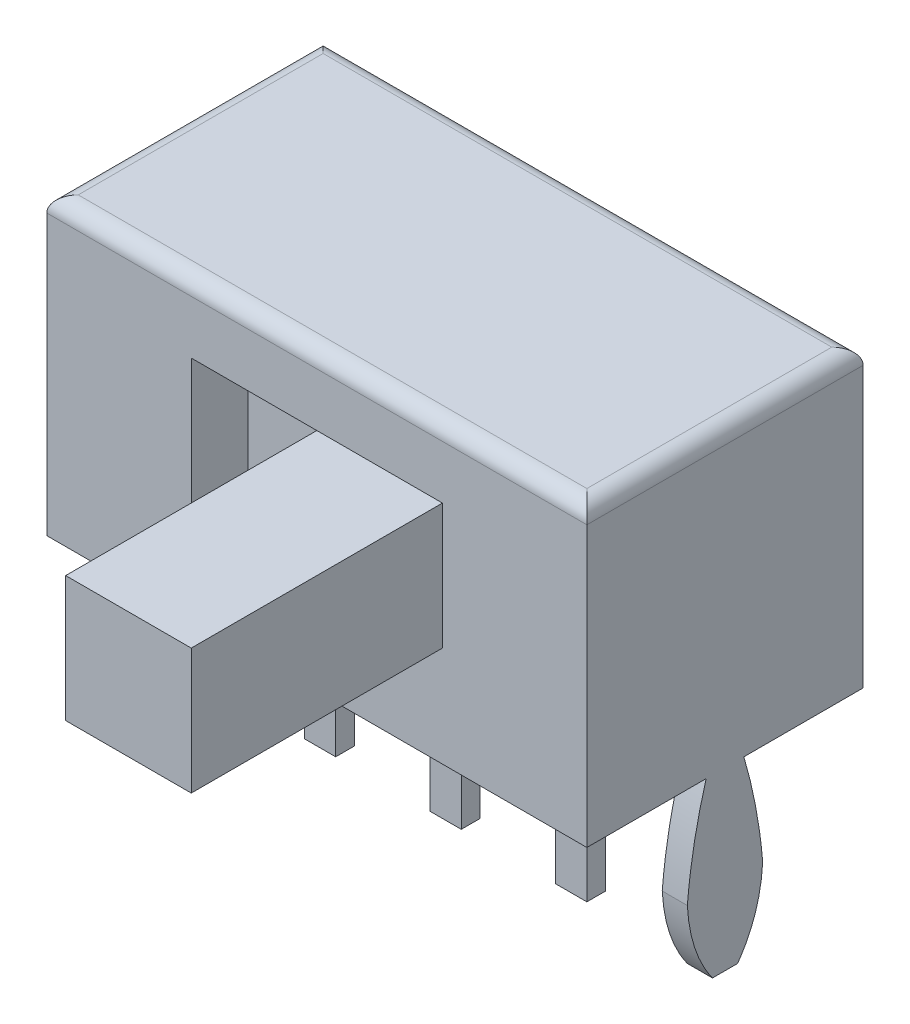
from build123d import *

# Parameters (mm, degrees)
SKETCH1_W           = 8.6
SKETCH1_H           = 4.4
BOSS_EXTRUDE1_DEPTH = 4.7
SKETCH4_W           = 4
SKETCH4_H           = 2
CUT_EXTRUDE1_DEPTH  = 0.9
SKETCH5_W           = 2
SKETCH5_H           = 2
BOSS_EXTRUDE3_DEPTH = 4.9
SKETCH7_W           = 0.4
SKETCH7_H           = 1.2
BOSS_EXTRUDE4_DEPTH = 2.8
CUT_EXTRUDE3_DEPTH  = 8.6
SKETCH9_W           = 0.5
SKETCH9_H           = 0.3
BOSS_EXTRUDE5_DEPTH = 2.8
FILLET1_R           = 0.25


with BuildPart() as part:
    # Sketch1 → Boss-Extrude1 (new body)
    with BuildSketch(Plane(origin=(0, 0, 0), x_dir=(1, 0, 0), z_dir=(0, 1, 0))):
        with Locations((4.3, -2.2)):
            Rectangle(SKETCH1_W, SKETCH1_H)
    extrude(amount=-BOSS_EXTRUDE1_DEPTH)

    # Sketch4 → Cut-Extrude1 (cut)
    with BuildSketch(Plane.XY.offset(4.4)):
        with Locations((4.3, -2.1)):
            Rectangle(SKETCH4_W, SKETCH4_H)
    extrude(amount=-CUT_EXTRUDE1_DEPTH, mode=Mode.SUBTRACT)

    # Sketch5 → Boss-Extrude3 (add)
    with BuildSketch(Plane.XY.offset(3.5)):
        with Locations((5.3, -2.1)):
            Rectangle(SKETCH5_W, SKETCH5_H)
    extrude(amount=BOSS_EXTRUDE3_DEPTH)

    # Sketch7 → Boss-Extrude4 (add)
    with BuildSketch(Plane.XZ.offset(4.7)):
        with Locations((0.2, 2.2)):
            Rectangle(SKETCH7_W, SKETCH7_H)
        with Locations((8.4, 2.2)):
            Rectangle(SKETCH7_W, SKETCH7_H)
    extrude(amount=BOSS_EXTRUDE4_DEPTH)

    # Sketch8 → Cut-Extrude3 (cut)
    with BuildSketch(Plane.ZY):
        with BuildLine():
            Line((1.9, -4.7), (1.6, -4.7))
            Line((1.6, -4.7), (1.6, -6.3))
            add(Edge.make_bspline(
                [(1.9, -4.7), (1.667864555, -5.492366311), (1.6, -6.3)],
                knots=[0, 0, 0, 0.547569636, 0.547569636, 0.547569636], degree=2))
        make_face()
        with BuildLine():
            add(Edge.make_bspline(
                [(2.5, -4.7), (2.732135445, -5.492366311), (2.8, -6.3)],
                knots=[0, 0, 0, 0.547569636, 0.547569636, 0.547569636], degree=2))
            Line((2.8, -6.3), (2.8, -4.7))
            Line((2.8, -4.7), (2.5, -4.7))
        make_face()
        with BuildLine():
            add(Edge.make_bspline(
                [(2.8, -6.3), (2.761794113, -6.997512334), (2.40000004, -7.5)],
                knots=[0, 0, 0, 0.682369162, 0.682369162, 0.682369162], degree=2))
            Line((2.40000004, -7.5), (2.8, -7.5))
            Line((2.8, -7.5), (2.8, -6.3))
        make_face()
        with BuildLine():
            add(Edge.make_bspline(
                [(1.6, -6.3), (1.638205887, -6.997512334), (1.99999996, -7.5)],
                knots=[0, 0, 0, 0.682369162, 0.682369162, 0.682369162], degree=2))
            Line((1.6, -6.3), (1.6, -7.5))
            Line((1.6, -7.5), (1.99999996, -7.5))
        make_face()
    extrude(amount=-CUT_EXTRUDE3_DEPTH, mode=Mode.SUBTRACT)

    # Sketch9 → Boss-Extrude5 (add)
    with BuildSketch(Plane.XZ.offset(4.7)):
        with Locations((4.3, 2.2)):
            Rectangle(SKETCH9_W, SKETCH9_H)
        with Locations((2.3, 2.2)):
            Rectangle(SKETCH9_W, SKETCH9_H)
        with Locations((6.3, 2.2)):
            Rectangle(SKETCH9_W, SKETCH9_H)
    extrude(amount=BOSS_EXTRUDE5_DEPTH)

    # Fillet1
    fillet1_edges = [part.edges().sort_by_distance(p)[0] for p in [
        (4.3, 0, 0),
        (8.6, 0, 2.2),
        (4.3, 0, 4.4),
        (0, 0, 2.2),
    ]]
    fillet(fillet1_edges, radius=FILLET1_R)


solid = part.part
